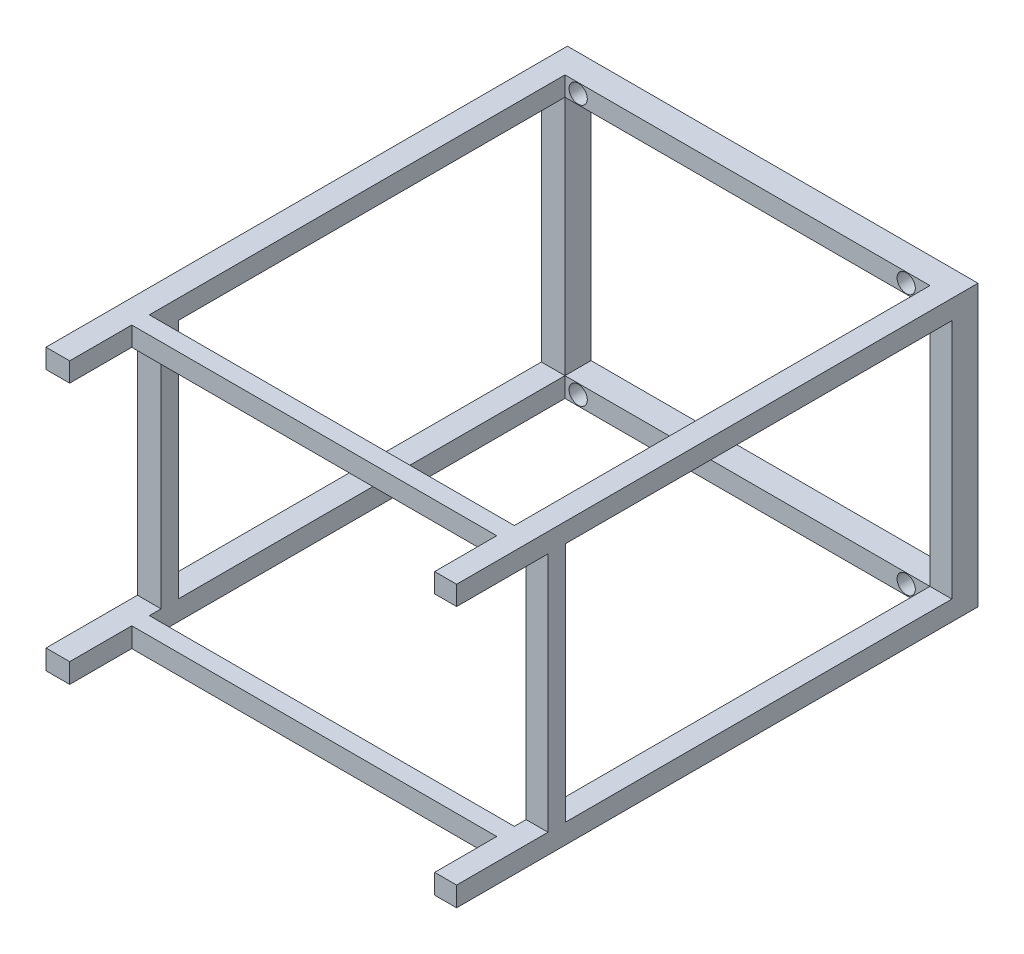
from build123d import *

# Parameters (mm, degrees)
SKETCH_13_W         = 280
SKETCH_13_H         = 14.842907488
EXTRUDE_14_DEPTH    = 20
SKETCH_13_W_2       = 18.151554109
SKETCH_13_H_2       = 185
EXTRUDE_14_2_DEPTH  = 20
SKETCH_13_H_3       = 15.157092512
EXTRUDE_14_3_DEPTH  = 20
SKETCH_13_W_3       = 16.848445891
EXTRUDE_14_4_DEPTH  = 20
SKETCH_29_W         = 18.151554109
SKETCH_29_H         = 14.842907488
SKETCH_29_W_2       = 16.848445891
SKETCH_29_H_2       = 15.157092512
EXTRUDE_15_DEPTH    = 400
EXTRUDE_START       = -16.848446
SKETCH_33_W         = 13.5
SKETCH_33_H         = 185
EXTRUDE_16_DEPTH    = 16.848446
EXTRUDE_START_2     = -18.151554
SKETCH_32_W         = 13.5
SKETCH_32_H         = 185
EXTRUDE_17_DEPTH    = 18.151554
EXTRUDE_START_3     = -14.842907
SKETCH_31_W         = 280
SKETCH_31_H         = 13.5
EXTRUDE_18_DEPTH    = 14.842907
SKETCH_30_W         = 280
SKETCH_30_H         = 13.5
EXTRUDE_19_DEPTH    = 15.15709
SKETCH_34_R         = 7
CUT_EXTRUDE_1_DEPTH = 20


with BuildPart() as part:
    # 草图13 → 凸台-拉伸14 (new body)
    with BuildSketch(Plane.XY):
        with Locations((158.151554109, 207.578546256)):
            Rectangle(SKETCH_13_W, SKETCH_13_H)
    extrude(amount=EXTRUDE_14_DEPTH)



with BuildPart() as body_2:
    # 草图13 → Extrude 14 2 (new body)
    with BuildSketch(Plane.XY):
        with Locations((9.075777055, 107.657092512)):
            Rectangle(SKETCH_13_W_2, SKETCH_13_H_2)
    extrude(amount=EXTRUDE_14_2_DEPTH)


with BuildPart() as body_3:
    # 草图13 → Extrude 14 3 (new body)
    with BuildSketch(Plane.XY):
        with Locations((158.151554109, 7.578546256)):
            Rectangle(SKETCH_13_W, SKETCH_13_H_3)
    extrude(amount=EXTRUDE_14_3_DEPTH)


with BuildPart() as body_4:
    # 草图13 → Extrude 14 4 (new body)
    with BuildSketch(Plane.XY):
        with Locations((306.575777055, 107.657092512)):
            Rectangle(SKETCH_13_W_3, SKETCH_13_H_2)
    extrude(amount=EXTRUDE_14_4_DEPTH)


with BuildPart() as part_1:
    add(part.part)

    add(body_2.part)  # 凸台-拉伸15 merges body 2

    add(body_3.part)  # 凸台-拉伸15 merges body 3

    add(body_4.part)  # 凸台-拉伸15 merges body 4
    # 草图29 → 凸台-拉伸15 (add)
    with BuildSketch(Plane.XY):
        with Locations((9.075777055, 207.578546256)):
            Rectangle(SKETCH_29_W, SKETCH_29_H)
        with Locations((306.575777055, 207.578546256)):
            Rectangle(SKETCH_29_W_2, SKETCH_29_H)
        with Locations((9.075777055, 7.578546256)):
            Rectangle(SKETCH_29_W, SKETCH_29_H_2)
        with Locations((306.575777055, 7.578546256)):
            Rectangle(SKETCH_29_W_2, SKETCH_29_H_2)
    extrude(amount=EXTRUDE_15_DEPTH)

    # 草图33 → 凸台-拉伸16 (add)
    with BuildSketch(Plane(origin=(315, 0, 0), x_dir=(0, 0, -1), z_dir=(1, 0, 0)).offset(EXTRUDE_START)):
        with Locations((-323.114974864, 107.657092512)):
            Rectangle(SKETCH_33_W, SKETCH_33_H)
    extrude(amount=EXTRUDE_16_DEPTH)

    # 草图32 → 凸台-拉伸17 (add)
    with BuildSketch(Plane.ZY.offset(EXTRUDE_START_2)):
        with Locations((323.114974864, 107.657092512)):
            Rectangle(SKETCH_32_W, SKETCH_32_H)
    extrude(amount=EXTRUDE_17_DEPTH)

    # 草图31 → 凸台-拉伸18 (add)
    with BuildSketch(Plane(origin=(0, 215, 0), x_dir=(1, 0, 0), z_dir=(0, 1, 0)).offset(EXTRUDE_START_3)):
        with Locations((158.151554109, -345.610164736)):
            Rectangle(SKETCH_31_W, SKETCH_31_H)
    extrude(amount=EXTRUDE_18_DEPTH)

    # 草图30 → 凸台-拉伸19 (add)
    with BuildSketch(Plane.XZ):
        with Locations((158.151554109, 345.610164736)):
            Rectangle(SKETCH_30_W, SKETCH_30_H)
    extrude(amount=-EXTRUDE_19_DEPTH)

    # 草图34 → 切除-拉伸1 (cut)
    with BuildSketch(Plane(origin=(0, 0, 0), x_dir=(-1, 0, 0), z_dir=(0, 0, -1))):
        with Locations((-279.91, 207.578546256)):
            Circle(SKETCH_34_R)
        with Locations((-279.91, 7.566753944)):
            Circle(SKETCH_34_R)
        with Locations((-28.27, 207.578546256)):
            Circle(SKETCH_34_R)
        with Locations((-28.27, 7.566753944)):
            Circle(SKETCH_34_R)
    extrude(amount=-CUT_EXTRUDE_1_DEPTH, mode=Mode.SUBTRACT)


solid = part_1.part
